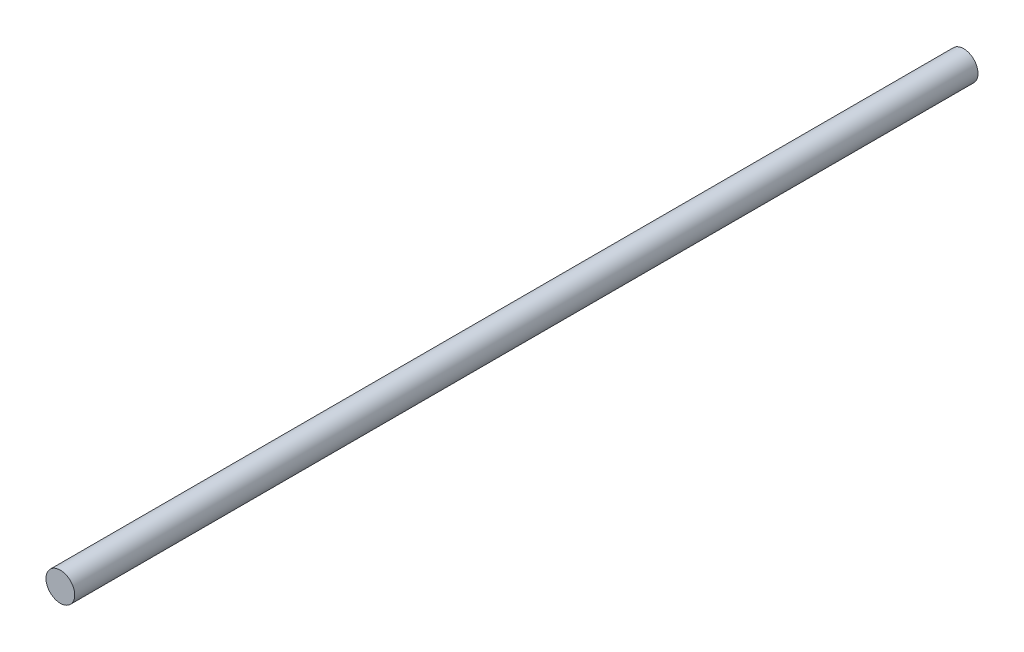
from build123d import *

# Parameters (mm, degrees)
SKETCH1_R           = 3.175
BOSS_EXTRUDE1_DEPTH = 199.644


with BuildPart() as part:
    # Sketch1 → Boss-Extrude1 (new body)
    with BuildSketch(Plane.XY):
        Circle(SKETCH1_R)
    extrude(amount=-BOSS_EXTRUDE1_DEPTH)


solid = part.part
